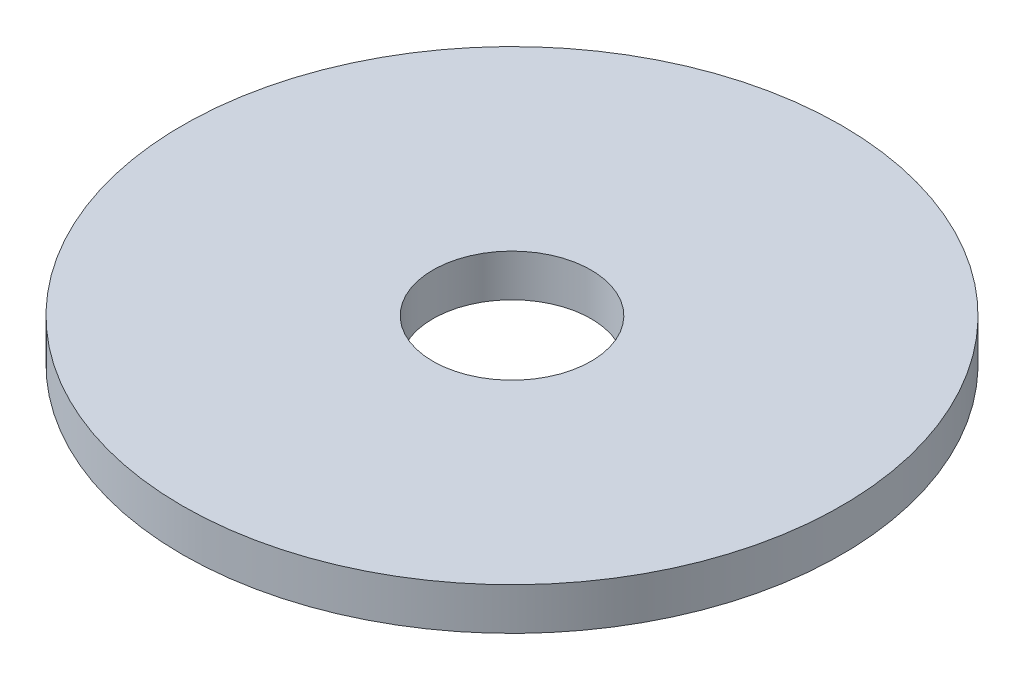
from build123d import *

# Parameters (mm, degrees)
SKETCH1_R           = 12.5
SKETCH1_R_2         = 3
BOSS_EXTRUDE1_DEPTH = 1.6


with BuildPart() as part:
    # Sketch1 → Boss-Extrude1 (new body)
    with BuildSketch(Plane(origin=(0, 0, 0), x_dir=(1, 0, 0), z_dir=(0, 1, 0))):
        with Locations(Location((0, 0, 0), (0, 0, 270))):
            Circle(SKETCH1_R)
        with Locations(Location((0, 0, 0), (0, 0, 270))):
            Circle(SKETCH1_R_2, mode=Mode.SUBTRACT)
    extrude(amount=BOSS_EXTRUDE1_DEPTH)


solid = part.part
